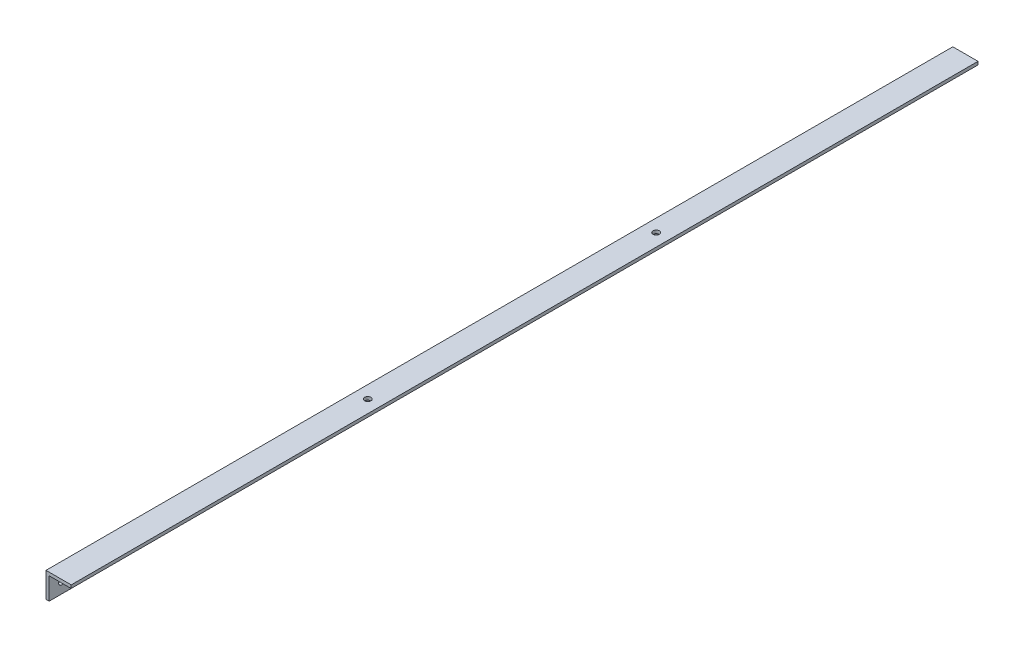
from build123d import *

# Parameters (mm, degrees)
BOSS_EXTRUDE1_DEPTH = 914.4
SKETCH2_R           = 3.175
CUT_EXTRUDE1_DEPTH  = 914.4
SKETCH3_R           = 3.175
CUT_EXTRUDE2_DEPTH  = 916.10528356
CUT_EXTRUDE3_REACH  = 917.023
SKETCH4_R           = 3.175


with BuildPart() as part:
    # Sketch1 → Boss-Extrude1 (new body)
    with BuildSketch(Plane.XY):
        Polygon((0, 0), (0, 25.4), (25.4, 25.4), (25.4, 22.225), (3.175, 22.225), (3.175, 0), align=None)
    extrude(amount=BOSS_EXTRUDE1_DEPTH)

    # Sketch2 → Cut-Extrude1 (cut)
    with BuildSketch(Plane.ZY):
        with Locations((338.1375, 12.7)):
            Circle(SKETCH2_R)
        with Locations((576.2625, 12.7)):
            Circle(SKETCH2_R)
    extrude(amount=-CUT_EXTRUDE1_DEPTH, mode=Mode.SUBTRACT)

    # Sketch3 → Cut-Extrude2 (cut, through all)
    with BuildSketch(Plane(origin=(0, 25.4, 0), x_dir=(1, 0, 0), z_dir=(0, 1, 0))):
        with Locations(Location((12.7, -602.591710243, 0), (0, 0, 270))):
            Circle(SKETCH3_R)
        with Locations(Location((12.7, -311.808289757, 0), (0, 0, 270))):
            Circle(SKETCH3_R)
    extrude(amount=-CUT_EXTRUDE2_DEPTH, mode=Mode.SUBTRACT)

    # Sketch4 → Cut-Extrude3 (cut, up to next)
    with BuildSketch(Plane(origin=(3.175, 0, 0), x_dir=(0, 0, -1), z_dir=(1, 0, 0)), mode=Mode.PRIVATE) as cut_extrude3_sk1:
        with Locations((-901.7, 11.1125)):
            Circle(SKETCH4_R)
    cut_extrude3_tool1 = extrude(cut_extrude3_sk1.sketch, amount=-CUT_EXTRUDE3_REACH, mode=Mode.PRIVATE) & part.part
    # Sketch4 → Cut-Extrude3 (cut, up to next)
    with BuildSketch(Plane(origin=(3.175, 0, 0), x_dir=(0, 0, -1), z_dir=(1, 0, 0)), mode=Mode.PRIVATE) as cut_extrude3_sk2:
        with Locations((-12.7, 11.1125)):
            Circle(SKETCH4_R)
    cut_extrude3_tool2 = extrude(cut_extrude3_sk2.sketch, amount=-CUT_EXTRUDE3_REACH, mode=Mode.PRIVATE) & part.part
    add(cut_extrude3_tool1.solids().sort_by_distance((3.175, 11.1125, 901.7))[0], mode=Mode.SUBTRACT)
    add(cut_extrude3_tool2.solids().sort_by_distance((3.175, 11.1125, 12.7))[0], mode=Mode.SUBTRACT)


solid = part.part
